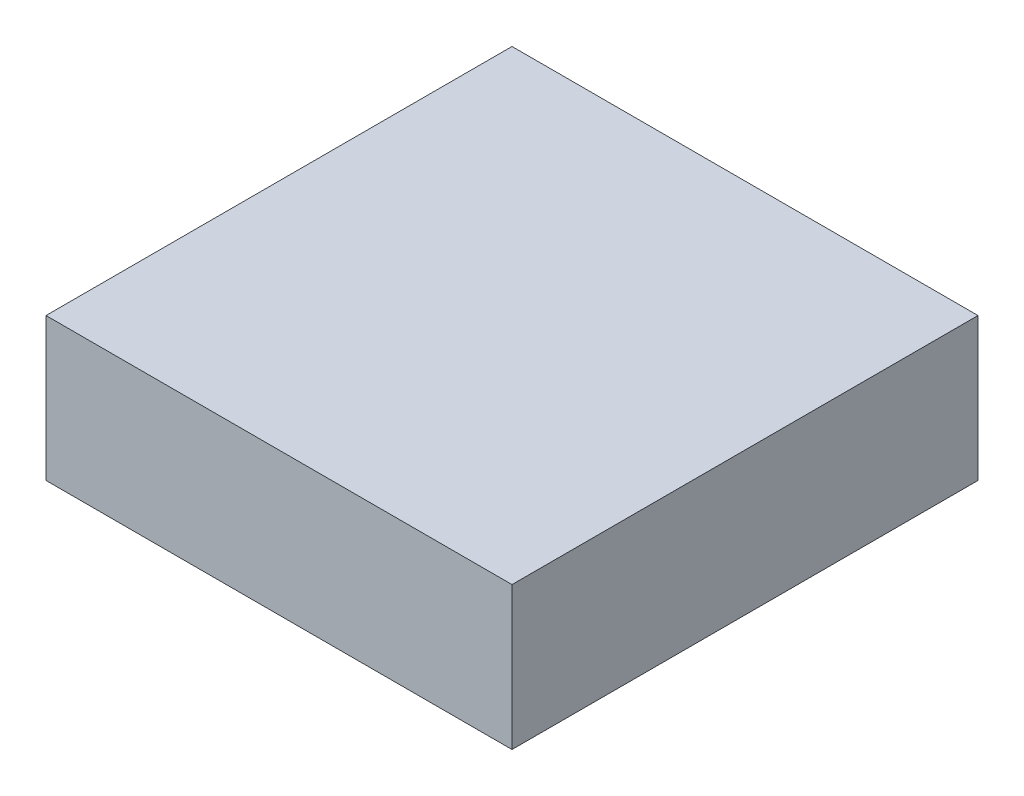
from build123d import *

# Parameters (mm, degrees)
SKETCH1_W      = 71.4
SKETCH1_H      = 21.89
ENVELOPE_DEPTH = 71.4


with BuildPart() as part:
    # Sketch1 → Envelope (new body)
    with BuildSketch(Plane.XY):
        Rectangle(SKETCH1_W, SKETCH1_H)
    extrude(amount=ENVELOPE_DEPTH)


solid = part.part
